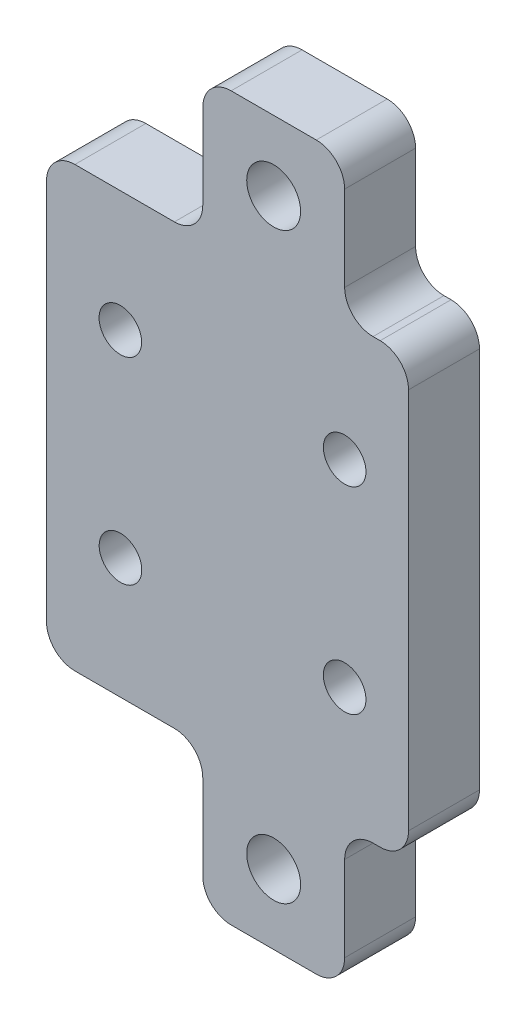
from build123d import *

# Parameters (mm, degrees)
SKETCH1_R           = 1.9
SKETCH1_R_2         = 1.500800978
SKETCH1_R_3         = 1.5
BOSS_EXTRUDE1_DEPTH = 5


with BuildPart() as part:
    # Sketch1 → Boss-Extrude1 (new body)
    with BuildSketch(Plane.XY):
        with BuildLine():
            Line((-6.997330295, -256.787047369), (-14.00854399, -256.787047369))
            ThreePointArc((-14.00854399, -256.787047369), (-15.422757553, -256.201260932), (-16.00854399, -254.787047369))
            Line((-16.00854399, -254.787047369), (-16.00854399, -227.870547218))
            ThreePointArc((-16.00854399, -227.870547218), (-15.422757553, -226.456333656), (-14.00854399, -225.870547218))
            Line((-14.00854399, -225.870547218), (-6.997330295, -225.870547218))
            ThreePointArc((-6.997330295, -225.870547218), (-5.583116733, -225.284760781), (-4.997330295, -223.870547218))
            Line((-4.997330295, -223.870547218), (-4.997330295, -217.870547218))
            ThreePointArc((-4.997330295, -217.870547218), (-4.411543858, -216.456333656), (-2.997330295, -215.870547218))
            Line((-2.997330295, -215.870547218), (3.002669705, -215.870547218))
            ThreePointArc((3.002669705, -215.870547218), (4.416883267, -216.456333656), (5.002669705, -217.870547218))
            Line((5.002669705, -217.870547218), (5.002669705, -223.870547218))
            ThreePointArc((5.002669705, -223.870547218), (5.588456142, -225.284760781), (7.002669705, -225.870547218))
            Line((7.002669705, -225.870547218), (7.505072862, -225.870547218))
            ThreePointArc((7.505072862, -225.870547218), (8.919286424, -226.456333656), (9.505072862, -227.870547218))
            Line((9.505072862, -227.870547218), (9.505072862, -254.787047369))
            ThreePointArc((9.505072862, -254.787047369), (8.919286424, -256.201260932), (7.505072862, -256.787047369))
            Line((7.505072862, -256.787047369), (7.002669705, -256.787047369))
            ThreePointArc((7.002669705, -256.787047369), (5.588456142, -257.372833807), (5.002669705, -258.787047369))
            Line((5.002669705, -258.787047369), (5.002669705, -264.787047369))
            ThreePointArc((5.002669705, -264.787047369), (4.416883267, -266.201260932), (3.002669705, -266.787047369))
            Line((3.002669705, -266.787047369), (-2.997330295, -266.787047369))
            ThreePointArc((-2.997330295, -266.787047369), (-4.411543858, -266.201260932), (-4.997330295, -264.787047369))
            Line((-4.997330295, -264.787047369), (-4.997330295, -258.787047369))
            ThreePointArc((-4.997330295, -258.787047369), (-5.583116733, -257.372833807), (-6.997330295, -256.787047369))
        make_face()
        with Locations((0, -261.876090751)):
            Circle(SKETCH1_R, mode=Mode.SUBTRACT)
        with Locations((5.002669705, -234.375086095)):
            Circle(SKETCH1_R_2, mode=Mode.SUBTRACT)
        with Locations((-10.805767266, -234.375086095)):
            Circle(SKETCH1_R_2, mode=Mode.SUBTRACT)
        with Locations(Location((0, -220.781503837, 0), (0, 0, 180))):
            Circle(SKETCH1_R, mode=Mode.SUBTRACT)
        with Locations((5.002669705, -248.275086095)):
            Circle(SKETCH1_R_3, mode=Mode.SUBTRACT)
        with Locations((-10.797330295, -248.275086095)):
            Circle(SKETCH1_R_3, mode=Mode.SUBTRACT)
    extrude(amount=BOSS_EXTRUDE1_DEPTH)


solid = part.part
